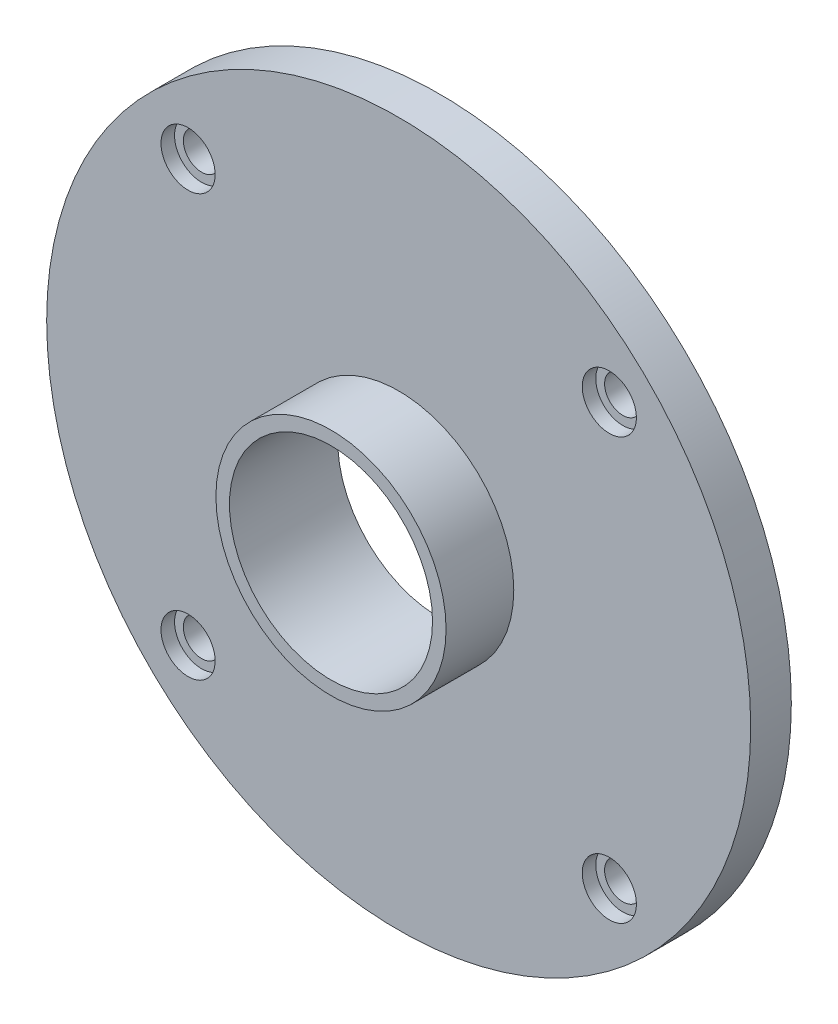
from build123d import *

# Parameters (mm, degrees)
SKETCH_1_R          = 26
EXTRUDE_1_DEPTH     = 3
SKETCH_2_R          = 7.5
CUT_EXTRUDE_1_DEPTH = 37.891733491
EXTRUDE_START       = 5
SKETCH_3_R          = 8.5
SKETCH_3_R_2        = 7.5
EXTRUDE_3_DEPTH     = 5
SKETCH_4_R          = 1.35
CUT_EXTRUDE_2_DEPTH = 38.107950631
SKETCH_5_R          = 2
CUT_EXTRUDE_3_DEPTH = 1


with BuildPart() as part:
    # Эскиз1 → Бобышка-Вытянуть1 (new body)
    with BuildSketch(Plane.XY):
        Circle(SKETCH_1_R)
    extrude(amount=EXTRUDE_1_DEPTH)

    # Эскиз2 → Вырез-Вытянуть1 (cut, through all)
    with BuildSketch(Plane.XY.offset(3)):
        Circle(SKETCH_2_R)
    extrude(amount=-CUT_EXTRUDE_1_DEPTH, mode=Mode.SUBTRACT)

    # Эскиз3 → Бобышка-Вытянуть3 (add)
    with BuildSketch(Plane.XY.offset(3).offset(EXTRUDE_START)):
        Circle(SKETCH_3_R)
        Circle(SKETCH_3_R_2, mode=Mode.SUBTRACT)
    extrude(amount=-EXTRUDE_3_DEPTH)

    # Эскиз4 → Вырез-Вытянуть2 (cut, through all)
    with BuildSketch(Plane.XY.offset(3)):
        with Locations((-15.556349186, 15.556349186)):
            Circle(SKETCH_4_R)
        with Locations((15.556349186, 15.556349186)):
            Circle(SKETCH_4_R)
        with Locations((15.556349186, -15.556349186)):
            Circle(SKETCH_4_R)
        with Locations((-15.556349186, -15.556349186)):
            Circle(SKETCH_4_R)
    extrude(amount=-CUT_EXTRUDE_2_DEPTH, mode=Mode.SUBTRACT)

    # Эскиз5 → Вырез-Вытянуть3 (cut)
    with BuildSketch(Plane.XY.offset(3)):
        with Locations((-15.556349186, 15.556349186)):
            Circle(SKETCH_5_R)
        with Locations((15.556349186, 15.556349186)):
            Circle(SKETCH_5_R)
        with Locations((15.556349186, -15.556349186)):
            Circle(SKETCH_5_R)
        with Locations((-15.556349186, -15.556349186)):
            Circle(SKETCH_5_R)
    extrude(amount=-CUT_EXTRUDE_3_DEPTH, mode=Mode.SUBTRACT)


solid = part.part
